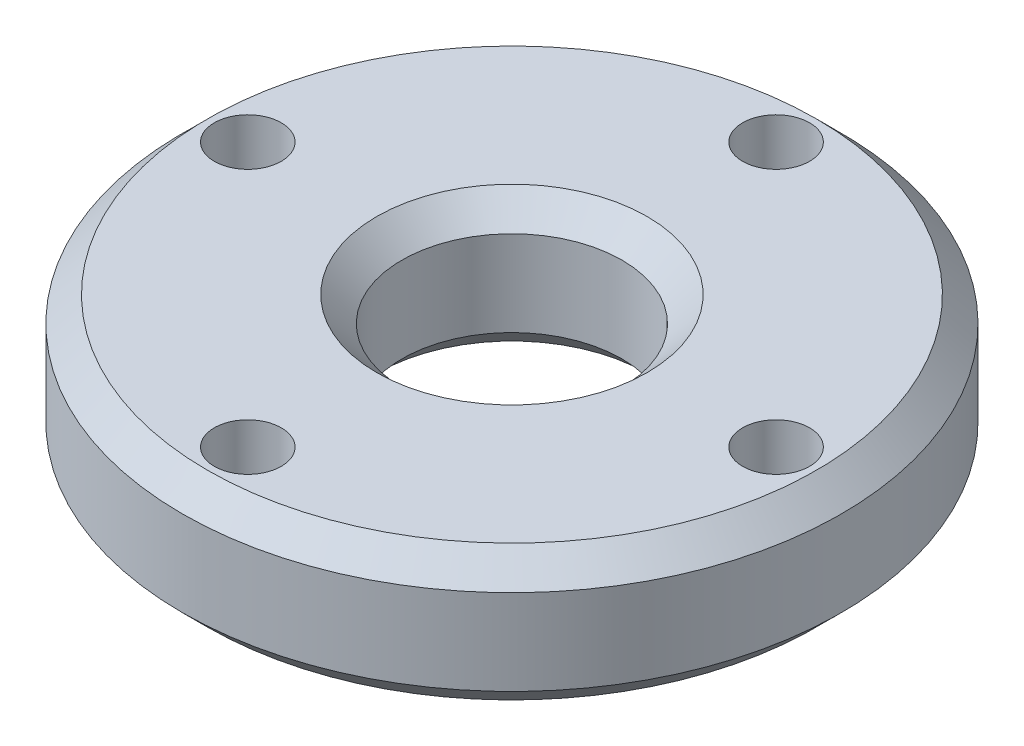
from build123d import *

# Parameters (mm, degrees)
SKETCH1_R           = 33.274
SKETCH1_R_2         = 11.1125
SKETCH1_R_3         = 3.3782
BOSS_EXTRUDE1_DEPTH = 13.716
CHAMFER1_SIZE       = 2.54


with BuildPart() as part:
    # Sketch1 → Boss-Extrude1 (new body)
    with BuildSketch(Plane(origin=(0, 0, 0), x_dir=(1, 0, 0), z_dir=(0, 1, 0))):
        with Locations(Location((0, 0, 0), (0, 0, 270))):
            Circle(SKETCH1_R)
        with Locations(Location((0, 0, 0), (0, 0, 270))):
            Circle(SKETCH1_R_2, mode=Mode.SUBTRACT)
        with Locations(Location((0, 26.67, 0), (0, 0, 270))):
            Circle(SKETCH1_R_3, mode=Mode.SUBTRACT)
        with Locations(Location((26.67, 0, 0), (0, 0, 270))):
            Circle(SKETCH1_R_3, mode=Mode.SUBTRACT)
        with Locations(Location((0, -26.67, 0), (0, 0, 270))):
            Circle(SKETCH1_R_3, mode=Mode.SUBTRACT)
        with Locations(Location((-26.67, 0, 0), (0, 0, 270))):
            Circle(SKETCH1_R_3, mode=Mode.SUBTRACT)
    extrude(amount=BOSS_EXTRUDE1_DEPTH)

    # Chamfer1
    chamfer1_edges = [part.edges().sort_by_distance(p)[0] for p in [
        (0, 0, -33.274),
        (0, 13.716, -33.274),
        (0, 0, -11.1125),
        (0, 13.716, -11.1125),
    ]]
    chamfer(chamfer1_edges, length=CHAMFER1_SIZE)


solid = part.part
